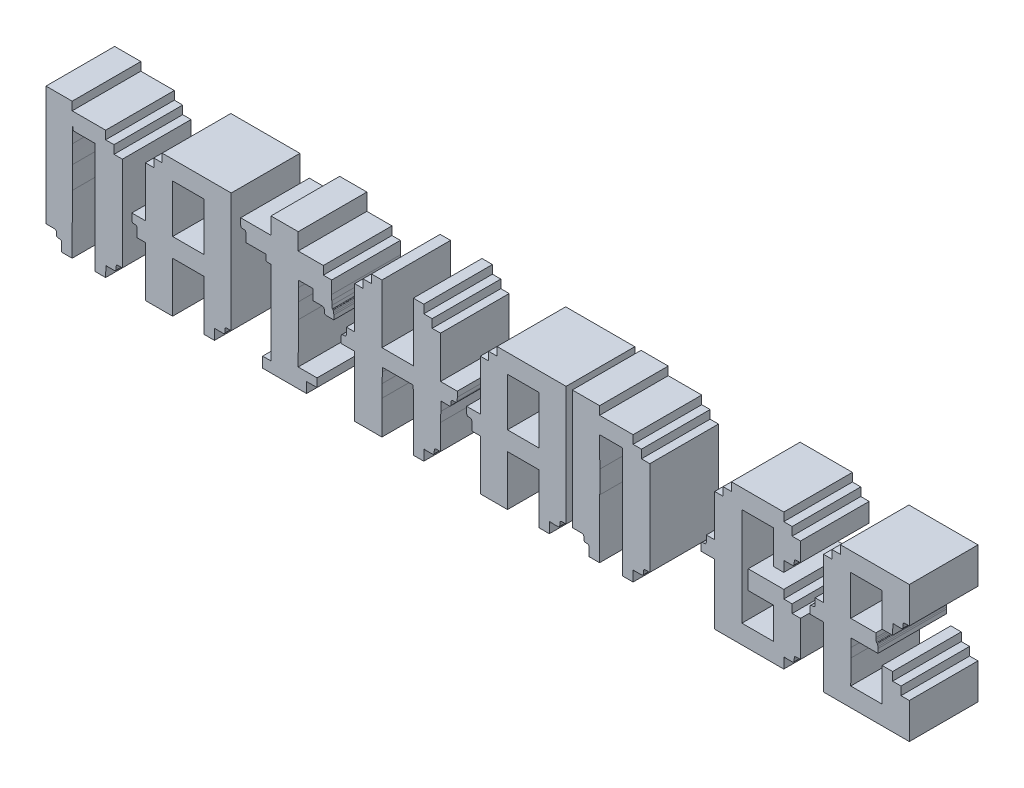
from build123d import *

# Parameters (mm, degrees)
BOSS_EXTRUDE2_DEPTH   = 5
BOSS_EXTRUDE2_2_DEPTH = 5
BOSS_EXTRUDE2_3_DEPTH = 5
BOSS_EXTRUDE2_4_DEPTH = 5
BOSS_EXTRUDE2_5_DEPTH = 5
BOSS_EXTRUDE2_6_DEPTH = 5
BOSS_EXTRUDE2_7_DEPTH = 5
BOSS_EXTRUDE2_8_DEPTH = 5
SCALE2_SCALE          = 0.5


with BuildPart() as part:
    # Sketch2 → Boss-Extrude2 (new body)
    with BuildSketch(Plane.XY):
        with BuildLine():
            Line((19.3929, 1.905), (19.7358, 1.905))
            Line((19.7358, 1.905), (19.7358, 2.2098))
            Line((19.7358, 2.2098), (19.7358, 2.5146))
            Line((19.7358, 2.5146), (19.3929, 2.5146))
            Line((19.3929, 2.5146), (18.9738, 2.5146))
            Line((18.9738, 2.5146), (18.669, 2.5146))
            Line((18.669, 2.5146), (18.3642, 2.5146))
            Line((18.3642, 2.5146), (18.376394819, 5.50545))
            ThreePointArc((18.376394819, 5.50545), (18.379262617, 6.070630989), (18.383256248, 6.635805143))
            ThreePointArc((18.383256248, 6.635805143), (18.387783852, 7.090408103), (18.394035272, 7.544990625))
            ThreePointArc((18.394035272, 7.544990625), (18.397189739, 7.77299779), (18.400684054, 8.001))
            Line((18.400684054, 8.001), (18.94052788, 8.001))
            Line((18.94052788, 8.001), (19.431, 8.001))
            Line((19.431, 8.001), (19.431, 7.62))
            Line((19.431, 7.62), (19.431, 7.239))
            Line((19.431, 7.239), (19.8501, 7.239))
            ThreePointArc((19.8501, 7.239), (19.986610311, 7.237907714), (20.123085662, 7.234630997))
            ThreePointArc((20.123085662, 7.234630997), (20.17062669, 7.227502229), (20.215225025, 7.209559063))
            ThreePointArc((20.215225025, 7.209559063), (20.243279736, 7.184663765), (20.25761219, 7.15000221))
            ThreePointArc((20.25761219, 7.15000221), (20.266298094, 7.080441158), (20.2692, 7.0104))
            ThreePointArc((20.2692, 7.0104), (20.27168993, 6.941595479), (20.279146767, 6.873150922))
            ThreePointArc((20.279146767, 6.873150922), (20.291648937, 6.839344411), (20.316825, 6.813550025))
            ThreePointArc((20.316825, 6.813550025), (20.355281815, 6.794823448), (20.397337996, 6.78702031))
            ThreePointArc((20.397337996, 6.78702031), (20.504687279, 6.783105261), (20.6121, 6.7818))
            Line((20.6121, 6.7818), (20.955, 6.7818))
            Line((20.955, 6.7818), (20.955, 7.0866))
            ThreePointArc((20.955, 7.0866), (20.953620186, 7.145070251), (20.949483882, 7.203410333))
            ThreePointArc((20.949483882, 7.203410333), (20.94290441, 7.25295536), (20.93261625, 7.301865))
            ThreePointArc((20.93261625, 7.301865), (20.922000229, 7.337600094), (20.908299077, 7.372269609))
            ThreePointArc((20.908299077, 7.372269609), (20.896379584, 7.386198736), (20.8788, 7.3914))
            ThreePointArc((20.8788, 7.3914), (20.856605044, 7.399817246), (20.845573219, 7.42083545))
            ThreePointArc((20.845573219, 7.42083545), (20.833376465, 7.529837412), (20.823237475, 7.63905))
            ThreePointArc((20.823237475, 7.63905), (20.813305546, 7.783117699), (20.807500346, 7.927410612))
            ThreePointArc((20.807500346, 7.927410612), (20.803825137, 8.116589441), (20.8026, 8.3058))
            Line((20.8026, 8.3058), (20.8026, 9.2202))
            Line((20.8026, 9.2202), (20.4978, 9.2202))
            Line((20.4978, 9.2202), (20.193, 9.2202))
            Line((20.193, 9.2202), (20.193, 9.525))
            Line((20.193, 9.525), (20.193, 9.8298))
            Line((20.193, 9.8298), (19.2786, 9.8298))
            Line((19.2786, 9.8298), (18.3642, 9.8298))
            Line((18.3642, 9.8298), (18.3642, 10.4394))
            Line((18.3642, 10.4394), (18.3642, 11.049))
            Line((18.3642, 11.049), (17.3736, 11.049))
            Line((17.3736, 11.049), (16.383, 11.049))
            Line((16.383, 11.049), (16.383, 10.4394))
            Line((16.383, 10.4394), (16.383, 9.8298))
            Line((16.383, 9.8298), (15.2781, 9.8298))
            Line((15.2781, 9.8298), (14.1732, 9.8298))
            Line((14.1732, 9.8298), (14.1732, 9.525))
            ThreePointArc((14.1732, 9.525), (14.17462907, 9.436503028), (14.178914924, 9.348098347))
            ThreePointArc((14.178914924, 9.348098347), (14.186671499, 9.30734752), (14.20415625, 9.26973))
            ThreePointArc((14.20415625, 9.26973), (14.227210729, 9.245337854), (14.257906511, 9.231763807))
            ThreePointArc((14.257906511, 9.231763807), (14.310488199, 9.22309956), (14.3637, 9.2202))
            ThreePointArc((14.3637, 9.2202), (14.418229618, 9.216755719), (14.471892494, 9.206477675))
            ThreePointArc((14.471892494, 9.206477675), (14.503471127, 9.190594406), (14.525625, 9.16305))
            ThreePointArc((14.525625, 9.16305), (14.542408137, 9.118197959), (14.549416926, 9.070824378))
            ThreePointArc((14.549416926, 9.070824378), (14.553004108, 8.955036879), (14.5542, 8.8392))
            Line((14.5542, 8.8392), (14.5542, 8.4582))
            Line((14.5542, 8.4582), (15.2781, 8.4582))
            Line((15.2781, 8.4582), (16.002, 8.4582))
            Line((16.002, 8.4582), (16.002, 8.2296))
            ThreePointArc((16.002, 8.2296), (16.003853978, 8.168010357), (16.009409307, 8.106643756))
            ThreePointArc((16.009409307, 8.106643756), (16.018559636, 8.072787688), (16.036924975, 8.04291))
            ThreePointArc((16.036924975, 8.04291), (16.061459303, 8.022047893), (16.091577901, 8.010644786))
            ThreePointArc((16.091577901, 8.010644786), (16.141809043, 8.003416663), (16.1925, 8.001))
            Line((16.1925, 8.001), (16.383, 8.001))
            Line((16.383, 8.001), (16.383, 4.953))
            Line((16.383, 4.953), (16.383, 1.905))
            Line((16.383, 1.905), (16.0782, 1.905))
            Line((16.0782, 1.905), (15.7734, 1.905))
            Line((15.7734, 1.905), (15.7734, 1.524))
            Line((15.7734, 1.524), (15.7734, 1.143))
            Line((15.7734, 1.143), (17.3736, 1.143))
            Line((17.3736, 1.143), (18.9738, 1.143))
            Line((18.9738, 1.143), (18.9738, 1.905))
            Line((18.9738, 1.905), (19.3929, 1.905))
        make_face()
    extrude(amount=BOSS_EXTRUDE2_DEPTH)


with BuildPart() as body_2:
    # Sketch2 → Boss-Extrude2 2 (new body)
    with BuildSketch(Plane.XY):
        with BuildLine():
            Line((56.6166, 8.3058), (56.6166, 6.7818))
            Line((56.6166, 6.7818), (56.3118, 6.7818))
            Line((56.3118, 6.7818), (56.007, 6.7818))
            Line((56.007, 6.7818), (56.007, 6.477))
            ThreePointArc((56.007, 6.477), (56.00557093, 6.388503028), (56.001285076, 6.300098347))
            ThreePointArc((56.001285076, 6.300098347), (55.993528501, 6.25934752), (55.97604375, 6.22173))
            ThreePointArc((55.97604375, 6.22173), (55.952989271, 6.197337854), (55.922293489, 6.183763807))
            ThreePointArc((55.922293489, 6.183763807), (55.869711801, 6.17509956), (55.8165, 6.1722))
            ThreePointArc((55.8165, 6.1722), (55.763288199, 6.16930044), (55.710706511, 6.160636193))
            ThreePointArc((55.710706511, 6.160636193), (55.680010729, 6.147062146), (55.65695625, 6.12267))
            ThreePointArc((55.65695625, 6.12267), (55.639471499, 6.08505248), (55.631714924, 6.044301653))
            ThreePointArc((55.631714924, 6.044301653), (55.62742907, 5.955896972), (55.626, 5.8674))
            Line((55.626, 5.8674), (55.626, 5.5626))
            Line((55.626, 5.5626), (56.1213, 5.5626))
            Line((56.1213, 5.5626), (56.6166, 5.5626))
            Line((56.6166, 5.5626), (56.6166, 3.3528))
            Line((56.6166, 3.3528), (56.6166, 1.143))
            Line((56.6166, 1.143), (59.7408, 1.143))
            Line((59.7408, 1.143), (62.865, 1.143))
            Line((62.865, 1.143), (62.865, 2.4384))
            Line((62.865, 2.4384), (62.865, 3.7338))
            Line((62.865, 3.7338), (62.5602, 3.7338))
            Line((62.5602, 3.7338), (62.2554, 3.7338))
            Line((62.2554, 3.7338), (62.2554, 4.0386))
            Line((62.2554, 4.0386), (62.2554, 4.3434))
            Line((62.2554, 4.3434), (61.9506, 4.3434))
            Line((61.9506, 4.3434), (61.6458, 4.3434))
            Line((61.6458, 4.3434), (61.6458, 4.6482))
            Line((61.6458, 4.6482), (61.6458, 4.953))
            Line((61.6458, 4.953), (61.2648, 4.953))
            Line((61.2648, 4.953), (60.8838, 4.953))
            Line((60.8838, 4.953), (60.8838, 3.7338))
            Line((60.8838, 3.7338), (60.8838, 2.5146))
            Line((60.8838, 2.5146), (59.7408, 2.5146))
            Line((59.7408, 2.5146), (58.5978, 2.5146))
            Line((58.5978, 2.5146), (58.609994819, 4.28625))
            ThreePointArc((58.609994819, 4.28625), (58.612846362, 4.617840703), (58.616835903, 4.949419667))
            ThreePointArc((58.616835903, 4.949419667), (58.621307255, 5.207094601), (58.627635272, 5.464730625))
            ThreePointArc((58.627635272, 5.464730625), (58.629072112, 5.513667095), (58.630625638, 5.5626))
            Line((58.630625638, 5.5626), (59.63132788, 5.5626))
            Line((59.63132788, 5.5626), (60.579, 5.5626))
            Line((60.579, 5.5626), (60.579, 5.8674))
            ThreePointArc((60.579, 5.8674), (60.577620186, 5.925870251), (60.573483882, 5.984210333))
            ThreePointArc((60.573483882, 5.984210333), (60.56690441, 6.03375536), (60.55661625, 6.082665))
            ThreePointArc((60.55661625, 6.082665), (60.546000229, 6.118400094), (60.532299077, 6.153069609))
            ThreePointArc((60.532299077, 6.153069609), (60.520379584, 6.166998736), (60.5028, 6.1722))
            ThreePointArc((60.5028, 6.1722), (60.485220416, 6.177401264), (60.473300923, 6.191330391))
            ThreePointArc((60.473300923, 6.191330391), (60.459599771, 6.225999906), (60.44898375, 6.261735))
            ThreePointArc((60.44898375, 6.261735), (60.43869559, 6.31064464), (60.432116118, 6.360189667))
            ThreePointArc((60.432116118, 6.360189667), (60.427979814, 6.418529749), (60.4266, 6.477))
            Line((60.4266, 6.477), (60.4266, 6.7818))
            Line((60.4266, 6.7818), (59.5122, 6.7818))
            Line((59.5122, 6.7818), (58.5978, 6.7818))
            Line((58.5978, 6.7818), (58.5978, 8.2296))
            Line((58.5978, 8.2296), (58.5978, 9.6774))
            Line((58.5978, 9.6774), (59.7408, 9.6774))
            Line((59.7408, 9.6774), (60.8838, 9.6774))
            Line((60.8838, 9.6774), (60.8838, 8.4582))
            Line((60.8838, 8.4582), (60.8838, 7.239))
            Line((60.8838, 7.239), (61.2648, 7.239))
            Line((61.2648, 7.239), (61.6458, 7.239))
            Line((61.6458, 7.239), (61.666171403, 8.007069635))
            ThreePointArc((61.666171403, 8.007069635), (61.932438732, 7.985816479), (62.199548095, 7.984211679))
            ThreePointArc((62.199548095, 7.984211679), (62.240193199, 7.985660855), (62.280822422, 7.98750228))
            ThreePointArc((62.280822422, 7.98750228), (62.322529181, 7.995360393), (62.360587287, 8.014142943))
            ThreePointArc((62.360587287, 8.014142943), (62.385572396, 8.040010484), (62.397960948, 8.073773024))
            ThreePointArc((62.397960948, 8.073773024), (62.405344538, 8.142115558), (62.407809951, 8.210811562))
            ThreePointArc((62.407809951, 8.210811562), (62.409790059, 8.275263558), (62.415723016, 8.339472442))
            ThreePointArc((62.415723016, 8.339472442), (62.425647723, 8.372915147), (62.445909951, 8.401311562))
            ThreePointArc((62.445909951, 8.401311562), (62.474306366, 8.42157379), (62.50774907, 8.431498496))
            ThreePointArc((62.50774907, 8.431498496), (62.571957954, 8.437431453), (62.636409951, 8.439411562))
            Line((62.636409951, 8.439411562), (62.865009951, 8.439411562))
            Line((62.865009951, 8.439411562), (62.865009951, 9.734811562))
            Line((62.865009951, 9.734811562), (62.865009951, 11.049))
            Line((62.865009951, 11.049), (60.3504, 11.049))
            Line((60.3504, 11.049), (57.8358, 11.049))
            Line((57.8358, 11.049), (57.8358, 10.7442))
            Line((57.8358, 10.7442), (57.8358, 10.4394))
            Line((57.8358, 10.4394), (57.531, 10.4394))
            Line((57.531, 10.4394), (57.2262, 10.4394))
            Line((57.2262, 10.4394), (57.2262, 10.1346))
            Line((57.2262, 10.1346), (57.2262, 9.8298))
            Line((57.2262, 9.8298), (56.9214, 9.8298))
            Line((56.9214, 9.8298), (56.6166, 9.8298))
            Line((56.6166, 9.8298), (56.6166, 8.3058))
        make_face()
    extrude(amount=BOSS_EXTRUDE2_2_DEPTH)


with BuildPart() as body_3:
    # Sketch2 → Boss-Extrude2 3 (new body)
    with BuildSketch(Plane.XY):
        with BuildLine():
            Line((48.6918, 8.3058), (48.6918, 6.7818))
            Line((48.6918, 6.7818), (48.387, 6.7818))
            Line((48.387, 6.7818), (48.0822, 6.7818))
            Line((48.0822, 6.7818), (48.0822, 6.477))
            ThreePointArc((48.0822, 6.477), (48.08077093, 6.388503028), (48.076485076, 6.300098347))
            ThreePointArc((48.076485076, 6.300098347), (48.068728501, 6.25934752), (48.05124375, 6.22173))
            ThreePointArc((48.05124375, 6.22173), (48.028189271, 6.197337854), (47.997493489, 6.183763807))
            ThreePointArc((47.997493489, 6.183763807), (47.944911801, 6.17509956), (47.8917, 6.1722))
            ThreePointArc((47.8917, 6.1722), (47.838488199, 6.16930044), (47.785906511, 6.160636193))
            ThreePointArc((47.785906511, 6.160636193), (47.755210729, 6.147062146), (47.73215625, 6.12267))
            ThreePointArc((47.73215625, 6.12267), (47.714671499, 6.08505248), (47.706914924, 6.044301653))
            ThreePointArc((47.706914924, 6.044301653), (47.70262907, 5.955896972), (47.7012, 5.8674))
            Line((47.7012, 5.8674), (47.7012, 5.5626))
            Line((47.7012, 5.5626), (48.1965, 5.5626))
            Line((48.1965, 5.5626), (48.6918, 5.5626))
            Line((48.6918, 5.5626), (48.6918, 3.3528))
            Line((48.6918, 3.3528), (48.6918, 1.143))
            Line((48.6918, 1.143), (51.2064, 1.143))
            Line((51.2064, 1.143), (53.721, 1.143))
            Line((53.721, 1.143), (53.733194819, 1.77165))
            ThreePointArc((53.733194819, 1.77165), (53.736294236, 1.845963249), (53.739882284, 1.920254508))
            ThreePointArc((53.739882284, 1.920254508), (53.94219188, 1.906966223), (54.14492788, 1.905))
            ThreePointArc((54.14492788, 1.905), (54.250503322, 1.906322914), (54.356012471, 1.910290718))
            ThreePointArc((54.356012471, 1.910290718), (54.39771923, 1.918148832), (54.435777336, 1.936931381))
            ThreePointArc((54.435777336, 1.936931381), (54.460762445, 1.962798923), (54.473150998, 1.996561463))
            ThreePointArc((54.473150998, 1.996561463), (54.480534587, 2.064903996), (54.483, 2.1336))
            ThreePointArc((54.483, 2.1336), (54.484980108, 2.198051997), (54.490913065, 2.262260881))
            ThreePointArc((54.490913065, 2.262260881), (54.500837772, 2.295703585), (54.5211, 2.3241))
            ThreePointArc((54.5211, 2.3241), (54.549496415, 2.344362228), (54.582939119, 2.354286935))
            ThreePointArc((54.582939119, 2.354286935), (54.647148003, 2.360219892), (54.7116, 2.3622))
            Line((54.7116, 2.3622), (54.9402, 2.3622))
            Line((54.9402, 2.3622), (54.9402, 3.6576))
            Line((54.9402, 3.6576), (54.9402, 4.953))
            Line((54.9402, 4.953), (54.6354, 4.953))
            Line((54.6354, 4.953), (54.3306, 4.953))
            Line((54.3306, 4.953), (54.3306, 5.2578))
            Line((54.3306, 5.2578), (54.3306, 5.5626))
            Line((54.3306, 5.5626), (54.0258, 5.5626))
            Line((54.0258, 5.5626), (53.721, 5.5626))
            Line((53.721, 5.5626), (53.721, 5.8674))
            Line((53.721, 5.8674), (53.721, 6.1722))
            Line((53.721, 6.1722), (52.4256, 6.1722))
            Line((52.4256, 6.1722), (51.1302, 6.1722))
            Line((51.1302, 6.1722), (51.1302, 5.4864))
            Line((51.1302, 5.4864), (51.1302, 4.8006))
            Line((51.1302, 4.8006), (52.0446, 4.8006))
            Line((52.0446, 4.8006), (52.959, 4.8006))
            Line((52.959, 4.8006), (52.959, 3.6576))
            Line((52.959, 3.6576), (52.959, 2.5146))
            Line((52.959, 2.5146), (51.816, 2.5146))
            Line((51.816, 2.5146), (50.673, 2.5146))
            Line((50.673, 2.5146), (50.673, 6.096))
            Line((50.673, 6.096), (50.673, 9.6774))
            Line((50.673, 9.6774), (51.816, 9.6774))
            Line((51.816, 9.6774), (52.959, 9.6774))
            Line((52.959, 9.6774), (52.959, 8.4582))
            Line((52.959, 8.4582), (52.959, 7.239))
            Line((52.959, 7.239), (53.34, 7.239))
            Line((53.34, 7.239), (53.721, 7.239))
            Line((53.721, 7.239), (53.739882284, 8.007069635))
            ThreePointArc((53.739882284, 8.007069635), (53.942320301, 7.998377167), (54.14492788, 8.001))
            ThreePointArc((54.14492788, 8.001), (54.250503322, 8.002322914), (54.356012471, 8.006290718))
            ThreePointArc((54.356012471, 8.006290718), (54.39771923, 8.014148832), (54.435777336, 8.032931381))
            ThreePointArc((54.435777336, 8.032931381), (54.460762445, 8.058798923), (54.473150998, 8.092561463))
            ThreePointArc((54.473150998, 8.092561463), (54.480534587, 8.160903996), (54.483, 8.2296))
            ThreePointArc((54.483, 8.2296), (54.484980108, 8.294051997), (54.490913065, 8.358260881))
            ThreePointArc((54.490913065, 8.358260881), (54.500837772, 8.391703585), (54.5211, 8.4201))
            ThreePointArc((54.5211, 8.4201), (54.549496415, 8.440362228), (54.582939119, 8.450286935))
            ThreePointArc((54.582939119, 8.450286935), (54.647148003, 8.456219892), (54.7116, 8.4582))
            Line((54.7116, 8.4582), (54.9402, 8.4582))
            Line((54.9402, 8.4582), (54.9402, 9.144))
            Line((54.9402, 9.144), (54.9402, 9.8298))
            Line((54.9402, 9.8298), (54.6354, 9.8298))
            Line((54.6354, 9.8298), (54.3306, 9.8298))
            Line((54.3306, 9.8298), (54.3306, 10.1346))
            Line((54.3306, 10.1346), (54.3306, 10.4394))
            Line((54.3306, 10.4394), (54.0258, 10.4394))
            Line((54.0258, 10.4394), (53.721, 10.4394))
            Line((53.721, 10.4394), (53.721, 10.7442))
            Line((53.721, 10.7442), (53.721, 11.049))
            Line((53.721, 11.049), (51.816, 11.049))
            Line((51.816, 11.049), (49.911, 11.049))
            Line((49.911, 11.049), (49.911, 10.7442))
            Line((49.911, 10.7442), (49.911, 10.4394))
            Line((49.911, 10.4394), (49.6062, 10.4394))
            Line((49.6062, 10.4394), (49.3014, 10.4394))
            Line((49.3014, 10.4394), (49.3014, 10.1346))
            Line((49.3014, 10.1346), (49.3014, 9.8298))
            Line((49.3014, 9.8298), (48.9966, 9.8298))
            Line((48.9966, 9.8298), (48.6918, 9.8298))
            Line((48.6918, 9.8298), (48.6918, 8.3058))
        make_face()
    extrude(amount=BOSS_EXTRUDE2_3_DEPTH)


with BuildPart() as body_4:
    # Sketch2 → Boss-Extrude2 4 (new body)
    with BuildSketch(Plane.XY):
        with BuildLine():
            Line((38.3286, 11.049), (38.3286, 6.7056))
            Line((38.3286, 6.7056), (38.3286, 2.3622))
            Line((38.3286, 2.3622), (38.7477, 2.3622))
            ThreePointArc((38.7477, 2.3622), (38.884210311, 2.361107714), (39.020685662, 2.357830997))
            ThreePointArc((39.020685662, 2.357830997), (39.06822669, 2.350702229), (39.112825025, 2.332759063))
            ThreePointArc((39.112825025, 2.332759063), (39.140879736, 2.307863765), (39.15521219, 2.27320221))
            ThreePointArc((39.15521219, 2.27320221), (39.163898094, 2.203641158), (39.1668, 2.1336))
            ThreePointArc((39.1668, 2.1336), (39.168653978, 2.072010357), (39.174209307, 2.010643756))
            ThreePointArc((39.174209307, 2.010643756), (39.183359636, 1.976787688), (39.201724975, 1.94691))
            ThreePointArc((39.201724975, 1.94691), (39.226259303, 1.926047893), (39.256377901, 1.914644786))
            ThreePointArc((39.256377901, 1.914644786), (39.306609043, 1.907416663), (39.3573, 1.905))
            ThreePointArc((39.3573, 1.905), (39.411829618, 1.901555719), (39.465492494, 1.891277675))
            ThreePointArc((39.465492494, 1.891277675), (39.497071127, 1.875394406), (39.519225, 1.84785))
            ThreePointArc((39.519225, 1.84785), (39.536008137, 1.802997959), (39.543016926, 1.755624378))
            ThreePointArc((39.543016926, 1.755624378), (39.546604108, 1.639836879), (39.5478, 1.524))
            Line((39.5478, 1.524), (39.5478, 1.143))
            Line((39.5478, 1.143), (39.9288, 1.143))
            Line((39.9288, 1.143), (40.3098, 1.143))
            Line((40.3098, 1.143), (40.321994819, 5.42925))
            ThreePointArc((40.321994819, 5.42925), (40.32486971, 6.242728892), (40.328863945, 7.056203058))
            ThreePointArc((40.328863945, 7.056203058), (40.317114799, 8.138181997), (40.3098, 9.2202))
            Line((40.3098, 9.2202), (41.19092788, 9.2202))
            Line((41.19092788, 9.2202), (41.9862, 9.2202))
            Line((41.9862, 9.2202), (41.9862, 5.1816))
            Line((41.9862, 5.1816), (41.9862, 1.143))
            Line((41.9862, 1.143), (42.3672, 1.143))
            Line((42.3672, 1.143), (42.7482, 1.143))
            Line((42.7482, 1.143), (42.760394819, 1.77165))
            ThreePointArc((42.760394819, 1.77165), (42.760182383, 1.840970359), (42.760394819, 1.910290718))
            ThreePointArc((42.760394819, 1.910290718), (42.966186229, 1.901799368), (43.17212788, 1.905))
            ThreePointArc((43.17212788, 1.905), (43.277703322, 1.906322914), (43.383212471, 1.910290718))
            ThreePointArc((43.383212471, 1.910290718), (43.42491923, 1.918148832), (43.462977336, 1.936931381))
            ThreePointArc((43.462977336, 1.936931381), (43.487962445, 1.962798923), (43.500350998, 1.996561463))
            ThreePointArc((43.500350998, 1.996561463), (43.507734587, 2.064903996), (43.5102, 2.1336))
            ThreePointArc((43.5102, 2.1336), (43.512180108, 2.198051997), (43.518113065, 2.262260881))
            ThreePointArc((43.518113065, 2.262260881), (43.528037772, 2.295703585), (43.5483, 2.3241))
            ThreePointArc((43.5483, 2.3241), (43.576696415, 2.344362228), (43.610139119, 2.354286935))
            ThreePointArc((43.610139119, 2.354286935), (43.674348003, 2.360219892), (43.7388, 2.3622))
            Line((43.7388, 2.3622), (43.9674, 2.3622))
            Line((43.9674, 2.3622), (43.9674, 5.7912))
            Line((43.9674, 5.7912), (43.9674, 9.2202))
            Line((43.9674, 9.2202), (43.6626, 9.2202))
            Line((43.6626, 9.2202), (43.3578, 9.2202))
            Line((43.3578, 9.2202), (43.3578, 9.525))
            Line((43.3578, 9.525), (43.3578, 9.8298))
            Line((43.3578, 9.8298), (43.053, 9.8298))
            Line((43.053, 9.8298), (42.7482, 9.8298))
            Line((42.7482, 9.8298), (42.7482, 10.1346))
            Line((42.7482, 10.1346), (42.7482, 10.4394))
            Line((42.7482, 10.4394), (41.529, 10.4394))
            Line((41.529, 10.4394), (40.3098, 10.4394))
            Line((40.3098, 10.4394), (40.3098, 10.7442))
            Line((40.3098, 10.7442), (40.3098, 11.049))
            Line((40.3098, 11.049), (39.3192, 11.049))
            Line((39.3192, 11.049), (38.3286, 11.049))
        make_face()
    extrude(amount=BOSS_EXTRUDE2_4_DEPTH)


with BuildPart() as body_5:
    # Sketch2 → Boss-Extrude2 5 (new body)
    with BuildSketch(Plane.XY):
        with BuildLine():
            Line((31.623, 8.001), (31.623, 6.1722))
            Line((31.623, 6.1722), (31.1277, 6.1722))
            Line((31.1277, 6.1722), (30.6324, 6.1722))
            Line((30.6324, 6.1722), (30.6324, 5.8674))
            ThreePointArc((30.6324, 5.8674), (30.63382907, 5.778903028), (30.638114924, 5.690498347))
            ThreePointArc((30.638114924, 5.690498347), (30.645871499, 5.64974752), (30.66335625, 5.61213))
            ThreePointArc((30.66335625, 5.61213), (30.686410729, 5.587737854), (30.717106511, 5.574163807))
            ThreePointArc((30.717106511, 5.574163807), (30.769688199, 5.56549956), (30.8229, 5.5626))
            ThreePointArc((30.8229, 5.5626), (30.877429618, 5.559155719), (30.931092494, 5.548877675))
            ThreePointArc((30.931092494, 5.548877675), (30.962671127, 5.532994406), (30.984825, 5.50545))
            ThreePointArc((30.984825, 5.50545), (31.001608137, 5.460597959), (31.008616926, 5.413224378))
            ThreePointArc((31.008616926, 5.413224378), (31.012204108, 5.297436879), (31.0134, 5.1816))
            Line((31.0134, 5.1816), (31.0134, 4.8006))
            Line((31.0134, 4.8006), (31.3182, 4.8006))
            Line((31.3182, 4.8006), (31.623, 4.8006))
            Line((31.623, 4.8006), (31.623, 2.9718))
            Line((31.623, 2.9718), (31.623, 1.143))
            Line((31.623, 1.143), (32.6136, 1.143))
            Line((32.6136, 1.143), (33.6042, 1.143))
            Line((33.6042, 1.143), (33.6042, 2.9718))
            Line((33.6042, 2.9718), (33.6042, 4.8006))
            Line((33.6042, 4.8006), (34.7472, 4.8006))
            Line((34.7472, 4.8006), (35.8902, 4.8006))
            Line((35.8902, 4.8006), (35.8902, 2.9718))
            Line((35.8902, 2.9718), (35.8902, 1.143))
            Line((35.8902, 1.143), (36.2712, 1.143))
            Line((36.2712, 1.143), (36.6522, 1.143))
            Line((36.6522, 1.143), (36.664394819, 1.77165))
            ThreePointArc((36.664394819, 1.77165), (36.666181443, 1.849817927), (36.668508406, 1.927971635))
            ThreePointArc((36.668508406, 1.927971635), (36.871994758, 1.910747517), (37.07612788, 1.905))
            ThreePointArc((37.07612788, 1.905), (37.181703322, 1.906322914), (37.287212471, 1.910290718))
            ThreePointArc((37.287212471, 1.910290718), (37.32891923, 1.918148832), (37.366977336, 1.936931381))
            ThreePointArc((37.366977336, 1.936931381), (37.391962445, 1.962798923), (37.404350998, 1.996561463))
            ThreePointArc((37.404350998, 1.996561463), (37.411734587, 2.064903996), (37.4142, 2.1336))
            ThreePointArc((37.4142, 2.1336), (37.416180108, 2.198051997), (37.422113065, 2.262260881))
            ThreePointArc((37.422113065, 2.262260881), (37.432037772, 2.295703585), (37.4523, 2.3241))
            ThreePointArc((37.4523, 2.3241), (37.480696415, 2.344362228), (37.514139119, 2.354286935))
            ThreePointArc((37.514139119, 2.354286935), (37.578348003, 2.360219892), (37.6428, 2.3622))
            Line((37.6428, 2.3622), (37.8714, 2.3622))
            Line((37.8714, 2.3622), (37.8714, 6.7056))
            Line((37.8714, 6.7056), (37.8714, 11.049))
            Line((37.8714, 11.049), (35.3568, 11.049))
            Line((35.3568, 11.049), (32.8422, 11.049))
            Line((32.8422, 11.049), (32.8422, 10.7442))
            Line((32.8422, 10.7442), (32.8422, 10.4394))
            Line((32.8422, 10.4394), (32.5374, 10.4394))
            Line((32.5374, 10.4394), (32.2326, 10.4394))
            Line((32.2326, 10.4394), (32.2326, 10.1346))
            Line((32.2326, 10.1346), (32.2326, 9.8298))
            Line((32.2326, 9.8298), (31.9278, 9.8298))
            Line((31.9278, 9.8298), (31.623, 9.8298))
            Line((31.623, 9.8298), (31.623, 8.001))
        make_face()
        Polygon((33.6042, 6.1722), (33.6042, 7.9248), (33.6042, 9.6774), (34.7472, 9.6774), (35.8902, 9.6774), (35.8902, 7.9248), (35.8902, 6.1722), (34.7472, 6.1722), align=None, mode=Mode.SUBTRACT)
    extrude(amount=BOSS_EXTRUDE2_5_DEPTH)


with BuildPart() as body_6:
    # Sketch2 → Boss-Extrude2 6 (new body)
    with BuildSketch(Plane.XY):
        with BuildLine():
            Line((22.479, 8.3058), (22.479, 6.7818))
            Line((22.479, 6.7818), (22.1742, 6.7818))
            Line((22.1742, 6.7818), (21.8694, 6.7818))
            Line((21.8694, 6.7818), (21.8694, 6.477))
            ThreePointArc((21.8694, 6.477), (21.86797093, 6.388503028), (21.863685076, 6.300098347))
            ThreePointArc((21.863685076, 6.300098347), (21.855928501, 6.25934752), (21.83844375, 6.22173))
            ThreePointArc((21.83844375, 6.22173), (21.815389271, 6.197337854), (21.784693489, 6.183763807))
            ThreePointArc((21.784693489, 6.183763807), (21.732111801, 6.17509956), (21.6789, 6.1722))
            ThreePointArc((21.6789, 6.1722), (21.625688199, 6.16930044), (21.573106511, 6.160636193))
            ThreePointArc((21.573106511, 6.160636193), (21.542410729, 6.147062146), (21.51935625, 6.12267))
            ThreePointArc((21.51935625, 6.12267), (21.501871499, 6.08505248), (21.494114924, 6.044301653))
            ThreePointArc((21.494114924, 6.044301653), (21.48982907, 5.955896972), (21.4884, 5.8674))
            Line((21.4884, 5.8674), (21.4884, 5.5626))
            Line((21.4884, 5.5626), (21.9837, 5.5626))
            Line((21.9837, 5.5626), (22.479, 5.5626))
            Line((22.479, 5.5626), (22.479, 3.3528))
            Line((22.479, 3.3528), (22.479, 1.143))
            Line((22.479, 1.143), (23.4696, 1.143))
            Line((23.4696, 1.143), (24.4602, 1.143))
            Line((24.4602, 1.143), (24.472394819, 3.60045))
            ThreePointArc((24.472394819, 3.60045), (24.475257251, 4.063412848), (24.479250229, 4.526367325))
            ThreePointArc((24.479250229, 4.526367325), (24.483760301, 4.894835015), (24.490035272, 5.263276875))
            ThreePointArc((24.490035272, 5.263276875), (24.493093067, 5.412941663), (24.49645176, 5.5626))
            Line((24.49645176, 5.5626), (25.49372788, 5.5626))
            Line((25.49372788, 5.5626), (26.733298283, 5.5626))
            ThreePointArc((26.733298283, 5.5626), (26.740510701, 5.365318483), (26.743382657, 5.167926062))
            ThreePointArc((26.743382657, 5.167926062), (26.745495746, 4.374664282), (26.7462, 3.5814))
            Line((26.7462, 3.5814), (26.7462, 1.143))
            Line((26.7462, 1.143), (27.1272, 1.143))
            Line((27.1272, 1.143), (27.5082, 1.143))
            Line((27.5082, 1.143), (27.520394819, 1.77165))
            ThreePointArc((27.520394819, 1.77165), (27.522181443, 1.849817927), (27.524508406, 1.927971635))
            ThreePointArc((27.524508406, 1.927971635), (27.727994758, 1.910747517), (27.93212788, 1.905))
            ThreePointArc((27.93212788, 1.905), (28.037703322, 1.906322914), (28.143212471, 1.910290718))
            ThreePointArc((28.143212471, 1.910290718), (28.18491923, 1.918148832), (28.222977336, 1.936931381))
            ThreePointArc((28.222977336, 1.936931381), (28.247962445, 1.962798923), (28.260350998, 1.996561463))
            ThreePointArc((28.260350998, 1.996561463), (28.267734587, 2.064903996), (28.2702, 2.1336))
            ThreePointArc((28.2702, 2.1336), (28.272180108, 2.198051997), (28.278113065, 2.262260881))
            ThreePointArc((28.278113065, 2.262260881), (28.288037772, 2.295703585), (28.3083, 2.3241))
            ThreePointArc((28.3083, 2.3241), (28.336696415, 2.344362228), (28.370139119, 2.354286935))
            ThreePointArc((28.370139119, 2.354286935), (28.434348003, 2.360219892), (28.4988, 2.3622))
            Line((28.4988, 2.3622), (28.7274, 2.3622))
            Line((28.7274, 2.3622), (28.739594819, 4.21005))
            ThreePointArc((28.739594819, 4.21005), (28.742448043, 4.556232676), (28.746438113, 4.902404114))
            ThreePointArc((28.746438113, 4.902404114), (28.75091528, 5.17239392), (28.757235272, 5.442346875))
            ThreePointArc((28.757235272, 5.442346875), (28.759232345, 5.512982247), (28.76143373, 5.583611546))
            ThreePointArc((28.76143373, 5.583611546), (28.956097933, 5.567856748), (29.15132788, 5.5626))
            ThreePointArc((29.15132788, 5.5626), (29.256903322, 5.563922914), (29.362412471, 5.567890718))
            ThreePointArc((29.362412471, 5.567890718), (29.40411923, 5.575748832), (29.442177336, 5.594531381))
            ThreePointArc((29.442177336, 5.594531381), (29.467162445, 5.620398923), (29.479550998, 5.654161463))
            ThreePointArc((29.479550998, 5.654161463), (29.486934587, 5.722503996), (29.4894, 5.7912))
            ThreePointArc((29.4894, 5.7912), (29.491380108, 5.855651997), (29.497313065, 5.919860881))
            ThreePointArc((29.497313065, 5.919860881), (29.507237772, 5.953303585), (29.5275, 5.9817))
            ThreePointArc((29.5275, 5.9817), (29.555896415, 6.001962228), (29.589339119, 6.011886935))
            ThreePointArc((29.589339119, 6.011886935), (29.653548003, 6.017819892), (29.718, 6.0198))
            ThreePointArc((29.718, 6.0198), (29.787521164, 6.02249044), (29.856626469, 6.030545724))
            ThreePointArc((29.856626469, 6.030545724), (29.890828855, 6.043954844), (29.91612, 6.070600025))
            ThreePointArc((29.91612, 6.070600025), (29.93443195, 6.112158401), (29.941858531, 6.156960991))
            ThreePointArc((29.941858531, 6.156960991), (29.945414567, 6.278857447), (29.9466, 6.4008))
            Line((29.9466, 6.4008), (29.9466, 6.7818))
            Line((29.9466, 6.7818), (29.337, 6.7818))
            Line((29.337, 6.7818), (28.7274, 6.7818))
            Line((28.7274, 6.7818), (28.7274, 8.3058))
            Line((28.7274, 8.3058), (28.7274, 9.8298))
            Line((28.7274, 9.8298), (28.4226, 9.8298))
            Line((28.4226, 9.8298), (28.1178, 9.8298))
            Line((28.1178, 9.8298), (28.1178, 10.1346))
            Line((28.1178, 10.1346), (28.1178, 10.4394))
            Line((28.1178, 10.4394), (27.813, 10.4394))
            Line((27.813, 10.4394), (27.5082, 10.4394))
            Line((27.5082, 10.4394), (27.5082, 10.7442))
            Line((27.5082, 10.7442), (27.5082, 11.049))
            Line((27.5082, 11.049), (27.1272, 11.049))
            Line((27.1272, 11.049), (26.7462, 11.049))
            Line((26.7462, 11.049), (26.7462, 8.9154))
            Line((26.7462, 8.9154), (26.7462, 6.7818))
            Line((26.7462, 6.7818), (25.6032, 6.7818))
            Line((25.6032, 6.7818), (24.4602, 6.7818))
            Line((24.4602, 6.7818), (24.4602, 8.9154))
            Line((24.4602, 8.9154), (24.4602, 11.049))
            Line((24.4602, 11.049), (24.0792, 11.049))
            Line((24.0792, 11.049), (23.6982, 11.049))
            Line((23.6982, 11.049), (23.6982, 10.7442))
            Line((23.6982, 10.7442), (23.6982, 10.4394))
            Line((23.6982, 10.4394), (23.3934, 10.4394))
            Line((23.3934, 10.4394), (23.0886, 10.4394))
            Line((23.0886, 10.4394), (23.0886, 10.1346))
            Line((23.0886, 10.1346), (23.0886, 9.8298))
            Line((23.0886, 9.8298), (22.7838, 9.8298))
            Line((22.7838, 9.8298), (22.479, 9.8298))
            Line((22.479, 9.8298), (22.479, 8.3058))
        make_face()
    extrude(amount=BOSS_EXTRUDE2_6_DEPTH)


with BuildPart() as body_7:
    # Sketch2 → Boss-Extrude2 7 (new body)
    with BuildSketch(Plane.XY):
        with BuildLine():
            Line((7.239, 9.8298), (7.239, 8.001))
            Line((7.239, 8.001), (7.239, 6.1722))
            Line((7.239, 6.1722), (6.7437, 6.1722))
            Line((6.7437, 6.1722), (6.2484, 6.1722))
            Line((6.2484, 6.1722), (6.2484, 5.8674))
            ThreePointArc((6.2484, 5.8674), (6.24982907, 5.778903028), (6.254114924, 5.690498347))
            ThreePointArc((6.254114924, 5.690498347), (6.261871499, 5.64974752), (6.27935625, 5.61213))
            ThreePointArc((6.27935625, 5.61213), (6.302410729, 5.587737854), (6.333106511, 5.574163807))
            ThreePointArc((6.333106511, 5.574163807), (6.385688199, 5.56549956), (6.4389, 5.5626))
            ThreePointArc((6.4389, 5.5626), (6.493429618, 5.559155719), (6.547092494, 5.548877675))
            ThreePointArc((6.547092494, 5.548877675), (6.578671127, 5.532994406), (6.600825, 5.50545))
            ThreePointArc((6.600825, 5.50545), (6.617608137, 5.460597959), (6.624616926, 5.413224378))
            ThreePointArc((6.624616926, 5.413224378), (6.628204108, 5.297436879), (6.6294, 5.1816))
            Line((6.6294, 5.1816), (6.6294, 4.8006))
            Line((6.6294, 4.8006), (6.9342, 4.8006))
            Line((6.9342, 4.8006), (7.239, 4.8006))
            Line((7.239, 4.8006), (7.239, 2.9718))
            Line((7.239, 2.9718), (7.239, 1.143))
            Line((7.239, 1.143), (8.2296, 1.143))
            Line((8.2296, 1.143), (9.2202, 1.143))
            Line((9.2202, 1.143), (9.2202, 2.9718))
            Line((9.2202, 2.9718), (9.2202, 4.8006))
            Line((9.2202, 4.8006), (10.3632, 4.8006))
            Line((10.3632, 4.8006), (11.5062, 4.8006))
            Line((11.5062, 4.8006), (11.5062, 2.9718))
            Line((11.5062, 2.9718), (11.5062, 1.143))
            Line((11.5062, 1.143), (11.8872, 1.143))
            Line((11.8872, 1.143), (12.2682, 1.143))
            Line((12.2682, 1.143), (12.280394819, 1.914644786))
            ThreePointArc((12.280394819, 1.914644786), (12.486124382, 1.903975279), (12.69212788, 1.905))
            ThreePointArc((12.69212788, 1.905), (12.797703322, 1.906322914), (12.903212471, 1.910290718))
            ThreePointArc((12.903212471, 1.910290718), (12.94491923, 1.918148832), (12.982977336, 1.936931381))
            ThreePointArc((12.982977336, 1.936931381), (13.007962445, 1.962798923), (13.020350998, 1.996561463))
            ThreePointArc((13.020350998, 1.996561463), (13.027734587, 2.064903996), (13.0302, 2.1336))
            ThreePointArc((13.0302, 2.1336), (13.032180108, 2.198051997), (13.038113065, 2.262260881))
            ThreePointArc((13.038113065, 2.262260881), (13.048037772, 2.295703585), (13.0683, 2.3241))
            ThreePointArc((13.0683, 2.3241), (13.096696415, 2.344362228), (13.130139119, 2.354286935))
            ThreePointArc((13.130139119, 2.354286935), (13.194348003, 2.360219892), (13.2588, 2.3622))
            Line((13.2588, 2.3622), (13.4874, 2.3622))
            Line((13.4874, 2.3622), (13.4874, 6.7056))
            Line((13.4874, 6.7056), (13.4874, 11.049))
            Line((13.4874, 11.049), (10.9728, 11.049))
            Line((10.9728, 11.049), (8.4582, 11.049))
            Line((8.4582, 11.049), (8.4582, 10.7442))
            Line((8.4582, 10.7442), (8.4582, 10.4394))
            Line((8.4582, 10.4394), (8.1534, 10.4394))
            Line((8.1534, 10.4394), (7.8486, 10.4394))
            Line((7.8486, 10.4394), (7.8486, 10.1346))
            Line((7.8486, 10.1346), (7.8486, 9.8298))
            Line((7.8486, 9.8298), (7.5438, 9.8298))
            Line((7.5438, 9.8298), (7.239, 9.8298))
        make_face()
        Polygon((11.5062, 9.6774), (11.5062, 7.9248), (11.5062, 6.1722), (10.3632, 6.1722), (9.2202, 6.1722), (9.2202, 7.9248), (9.2202, 9.6774), (10.3632, 9.6774), align=None, mode=Mode.SUBTRACT)
    extrude(amount=BOSS_EXTRUDE2_7_DEPTH)


with BuildPart() as body_8:
    # Sketch2 → Boss-Extrude2 8 (new body)
    with BuildSketch(Plane.XY):
        with BuildLine():
            Line((0, 11.049), (0, 6.7056))
            Line((0, 6.7056), (0, 2.3622))
            Line((0, 2.3622), (0.381, 2.3622))
            ThreePointArc((0.381, 2.3622), (0.502942553, 2.361014567), (0.624839009, 2.357458531))
            ThreePointArc((0.624839009, 2.357458531), (0.669641599, 2.35003195), (0.711199975, 2.33172))
            ThreePointArc((0.711199975, 2.33172), (0.737845156, 2.306428855), (0.751254276, 2.272226469))
            ThreePointArc((0.751254276, 2.272226469), (0.75930956, 2.203121164), (0.762, 2.1336))
            ThreePointArc((0.762, 2.1336), (0.763853978, 2.072010357), (0.769409307, 2.010643756))
            ThreePointArc((0.769409307, 2.010643756), (0.778559636, 1.976787688), (0.796924975, 1.94691))
            ThreePointArc((0.796924975, 1.94691), (0.821459303, 1.926047893), (0.851577901, 1.914644786))
            ThreePointArc((0.851577901, 1.914644786), (0.901809043, 1.907416663), (0.9525, 1.905))
            ThreePointArc((0.9525, 1.905), (1.007029618, 1.901555719), (1.060692494, 1.891277675))
            ThreePointArc((1.060692494, 1.891277675), (1.092271127, 1.875394406), (1.114425, 1.84785))
            ThreePointArc((1.114425, 1.84785), (1.131208137, 1.802997959), (1.138216926, 1.755624378))
            ThreePointArc((1.138216926, 1.755624378), (1.141804108, 1.639836879), (1.143, 1.524))
            Line((1.143, 1.524), (1.143, 1.143))
            Line((1.143, 1.143), (1.524, 1.143))
            Line((1.524, 1.143), (1.905, 1.143))
            Line((1.905, 1.143), (1.917194819, 5.42925))
            ThreePointArc((1.917194819, 5.42925), (1.92006971, 6.242728892), (1.924063945, 7.056203058))
            ThreePointArc((1.924063945, 7.056203058), (1.928615297, 7.719941736), (1.934835272, 8.383666875))
            ThreePointArc((1.934835272, 8.383666875), (1.940868331, 8.925410239), (1.947450715, 9.467147207))
            ThreePointArc((1.947450715, 9.467147207), (1.953458487, 9.473417425), (1.960122775, 9.46785))
            Line((1.960122775, 9.46785), (1.990855835, 9.2202))
            Line((1.990855835, 9.2202), (2.78612788, 9.2202))
            Line((2.78612788, 9.2202), (3.5814, 9.2202))
            Line((3.5814, 9.2202), (3.5814, 5.1816))
            Line((3.5814, 5.1816), (3.5814, 1.143))
            Line((3.5814, 1.143), (3.9624, 1.143))
            Line((3.9624, 1.143), (4.3434, 1.143))
            Line((4.3434, 1.143), (4.355594819, 1.77165))
            ThreePointArc((4.355594819, 1.77165), (4.357409783, 1.843153847), (4.359676909, 1.914644786))
            ThreePointArc((4.359676909, 1.914644786), (4.563366786, 1.904090705), (4.76732788, 1.905))
            ThreePointArc((4.76732788, 1.905), (4.872903322, 1.906322914), (4.978412471, 1.910290718))
            ThreePointArc((4.978412471, 1.910290718), (5.02011923, 1.918148832), (5.058177336, 1.936931381))
            ThreePointArc((5.058177336, 1.936931381), (5.083162445, 1.962798923), (5.095550998, 1.996561463))
            ThreePointArc((5.095550998, 1.996561463), (5.102934587, 2.064903996), (5.1054, 2.1336))
            ThreePointArc((5.1054, 2.1336), (5.107380108, 2.198051997), (5.113313065, 2.262260881))
            ThreePointArc((5.113313065, 2.262260881), (5.123237772, 2.295703585), (5.1435, 2.3241))
            ThreePointArc((5.1435, 2.3241), (5.171896415, 2.344362228), (5.205339119, 2.354286935))
            ThreePointArc((5.205339119, 2.354286935), (5.269548003, 2.360219892), (5.334, 2.3622))
            Line((5.334, 2.3622), (5.5626, 2.3622))
            Line((5.5626, 2.3622), (5.5626, 5.7912))
            Line((5.5626, 5.7912), (5.5626, 9.2202))
            Line((5.5626, 9.2202), (5.2578, 9.2202))
            Line((5.2578, 9.2202), (4.953, 9.2202))
            Line((4.953, 9.2202), (4.953, 9.525))
            Line((4.953, 9.525), (4.953, 9.8298))
            Line((4.953, 9.8298), (4.6482, 9.8298))
            Line((4.6482, 9.8298), (4.3434, 9.8298))
            Line((4.3434, 9.8298), (4.3434, 10.1346))
            Line((4.3434, 10.1346), (4.3434, 10.4394))
            Line((4.3434, 10.4394), (3.1242, 10.4394))
            Line((3.1242, 10.4394), (1.905, 10.4394))
            Line((1.905, 10.4394), (1.905, 10.7442))
            Line((1.905, 10.7442), (1.905, 11.049))
            Line((1.905, 11.049), (0.9525, 11.049))
            Line((0.9525, 11.049), (0, 11.049))
        make_face()
    extrude(amount=BOSS_EXTRUDE2_8_DEPTH)


with BuildPart() as body_8_1:
    # Scale2: scaled about (0, 0, 0)
    add(body_8.part.scale(SCALE2_SCALE))


with BuildPart() as body_7_1:
    # Scale2: scaled about (0, 0, 0)
    add(body_7.part.scale(SCALE2_SCALE))


with BuildPart() as part_1:
    # Scale2: scaled about (0, 0, 0)
    add(part.part.scale(SCALE2_SCALE))


with BuildPart() as body_6_1:
    # Scale2: scaled about (0, 0, 0)
    add(body_6.part.scale(SCALE2_SCALE))


with BuildPart() as body_5_1:
    # Scale2: scaled about (0, 0, 0)
    add(body_5.part.scale(SCALE2_SCALE))


with BuildPart() as body_4_1:
    # Scale2: scaled about (0, 0, 0)
    add(body_4.part.scale(SCALE2_SCALE))


with BuildPart() as body_3_1:
    # Scale2: scaled about (0, 0, 0)
    add(body_3.part.scale(SCALE2_SCALE))


with BuildPart() as body_2_1:
    # Scale2: scaled about (0, 0, 0)
    add(body_2.part.scale(SCALE2_SCALE))


solid = Compound([body_8_1.part, body_7_1.part, part_1.part, body_6_1.part, body_5_1.part, body_4_1.part, body_3_1.part, body_2_1.part])
